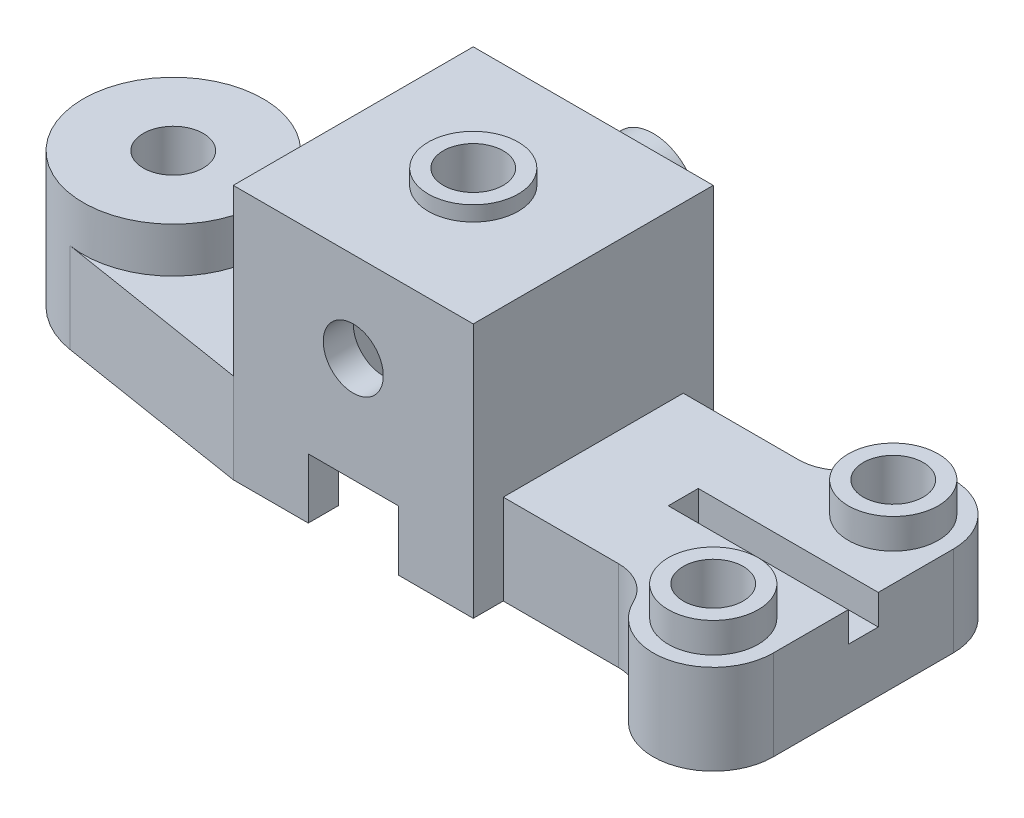
from build123d import *

# Parameters (mm, degrees)
SKETCH2_W                                = 80
SKETCH2_H                                = 80
BOSS_EXTRUDE1_DEPTH                      = 85
SKETCH3_W                                = 30
SKETCH3_H                                = 40
CUT_EXTRUDE1_DEPTH                       = 124.389626793
SKETCH4_R                                = 15
BOSS_EXTRUDE2_DEPTH                      = 20
SKETCH5_R                                = 15
BOSS_EXTRUDE3_DEPTH                      = 5
SKETCH7_R                                = 30
BOSS_EXTRUDE4_DEPTH                      = 45
BOSS_EXTRUDE5_DEPTH                      = 30
CUT_EXTRUDE2_DEPTH                       = 15
SKETCH11_W                               = 60
SKETCH11_H                               = 60
CUT_EXTRUDE3_DEPTH                       = 75
BOSS_EXTRUDE6_DEPTH                      = 30
SKETCH21_R                               = 15
BOSS_EXTRUDE7_DEPTH                      = 10
F_20_0_20_DIAMETER_HOLE1_D               = 20
F_20_0_20_DIAMETER_HOLE2_D               = 20
F_20_0_20_DIAMETER_HOLE3_D               = 20
CBORE_FOR_M10_HEX_HEAD_BOLT2_D           = 10
CBORE_FOR_M10_HEX_HEAD_BOLT2_CBORE_D     = 20
CBORE_FOR_M10_HEX_HEAD_BOLT2_CBORE_DEPTH = 15
BOSS_EXTRUDE9_DEPTH                      = 5
SKETCH25_W                               = 10
SKETCH25_H                               = 10
CUT_EXTRUDE4_DEPTH                       = 60
FILLET1_R                                = 10


with BuildPart() as part:
    # Sketch2 → Boss-Extrude1 (new body)
    with BuildSketch(Plane(origin=(0, 0, 0), x_dir=(1, 0, 0), z_dir=(0, 1, 0))):
        Rectangle(SKETCH2_W, SKETCH2_H)
    extrude(amount=BOSS_EXTRUDE1_DEPTH)

    # Sketch3 → Cut-Extrude1 (cut, through all)
    with BuildSketch(Plane.XY.offset(40)):
        Rectangle(SKETCH3_W, SKETCH3_H)
    extrude(amount=-CUT_EXTRUDE1_DEPTH, mode=Mode.SUBTRACT)

    # Sketch4 → Boss-Extrude2 (add)
    with BuildSketch(Plane(origin=(0, 0, -40), x_dir=(-1, 0, 0), z_dir=(0, 0, -1))):
        with Locations((0, 55)):
            Circle(SKETCH4_R)
    extrude(amount=BOSS_EXTRUDE2_DEPTH)

    # Sketch5 → Boss-Extrude3 (add)
    with BuildSketch(Plane(origin=(0, 85, 0), x_dir=(1, 0, 0), z_dir=(0, 1, 0))):
        with Locations(Location((0, 0, 0), (0, 0, 270))):
            Circle(SKETCH5_R)
    extrude(amount=BOSS_EXTRUDE3_DEPTH)



with BuildPart() as body_2:
    # Sketch7 → Boss-Extrude4 (new body)
    with BuildSketch(Plane(origin=(0, 0, 0), x_dir=(1, 0, 0), z_dir=(0, 1, 0))):
        with Locations(Location((-100, 0, 0), (0, 0, 90))):
            Circle(SKETCH7_R)
    extrude(amount=BOSS_EXTRUDE4_DEPTH)


with BuildPart() as part_1:
    add(part.part)

    add(body_2.part)  # Boss-Extrude5 merges body 2
    # Sketch9 → Boss-Extrude5 (add)
    with BuildSketch(Plane(origin=(0, 0, 0), x_dir=(1, 0, 0), z_dir=(0, 1, 0))):
        with BuildLine():
            Line((-40, 0), (-40, 40))
            Line((-40, 40), (-104.747935056, 29.621902584))
            ThreePointArc((-104.747935056, 29.621902584), (-80.53770378, 22.830221765), (-70, 0))
            Line((-70, 0), (-40, 0))
        make_face()
        with BuildLine():
            Line((-40, -40), (-40, 0))
            Line((-40, 0), (-70, 0))
            ThreePointArc((-70, 0), (-80.53770378, -22.830221765), (-104.747935056, -29.621902584))
            Line((-104.747935056, -29.621902584), (-40, -40))
        make_face()
    extrude(amount=BOSS_EXTRUDE5_DEPTH)

    # Sketch10 → Cut-Extrude2 (cut)
    with BuildSketch(Plane.XZ):
        with BuildLine():
            Line((-50, 28.269512751), (-103.165290037, 19.747935056))
            ThreePointArc((-103.165290037, 19.747935056), (-120, 0), (-103.165290037, -19.747935056))
            Line((-103.165290037, -19.747935056), (-50, -28.269512751))
            Line((-50, -28.269512751), (-50, 28.269512751))
        make_face()
    extrude(amount=-CUT_EXTRUDE2_DEPTH, mode=Mode.SUBTRACT)

    # Sketch11 → Cut-Extrude3 (cut)
    with BuildSketch(Plane.XZ):
        Rectangle(SKETCH11_W, SKETCH11_H)
    extrude(amount=-CUT_EXTRUDE3_DEPTH, mode=Mode.SUBTRACT)

    # Sketch12 → Boss-Extrude6 (add)
    with BuildSketch(Plane(origin=(0, 0, 0), x_dir=(1, 0, 0), z_dir=(0, 1, 0))):
        with BuildLine():
            Line((40, 30), (78.377223398, 30))
            ThreePointArc((78.377223398, 30), (86.395060656, 32.322686179), (91.929841942, 38.571428571))
            ThreePointArc((91.929841942, 38.571428571), (114.392996633, 49.511575554), (130, 30))
            Line((130, 30), (130, -30))
            ThreePointArc((130, -30), (114.392996633, -49.511575554), (91.929841942, -38.571428571))
            ThreePointArc((91.929841942, -38.571428571), (86.395060656, -32.322686179), (78.377223398, -30))
            Line((78.377223398, -30), (40, -30))
            Line((40, -30), (40, 30))
        make_face()
    extrude(amount=BOSS_EXTRUDE6_DEPTH)

    # Sketch21 → Boss-Extrude7 (add)
    with BuildSketch(Plane(origin=(0, 30, 0), x_dir=(1, 0, 0), z_dir=(0, 1, 0))):
        with Locations(Location((110, 30, 0), (0, 0, 90))):
            Circle(SKETCH21_R)
        with Locations(Location((110, -30, 0), (0, 0, 90))):
            Circle(SKETCH21_R)
    extrude(amount=BOSS_EXTRUDE7_DEPTH)

    # Ø20.0 (20) Diameter Hole1 (through all)
    with Locations(Plane(origin=(0, 45, 0), x_dir=(1, 0, 0), z_dir=(0, 1, 0))):
        with Locations((-100, 0)):
            Hole(F_20_0_20_DIAMETER_HOLE1_D / 2)

    # Ø20.0 (20) Diameter Hole2 (through all)
    with Locations(Plane(origin=(0, 90, 0), x_dir=(1, 0, 0), z_dir=(0, 1, 0))):
        with Locations((0, 0)):
            Hole(F_20_0_20_DIAMETER_HOLE2_D / 2)

    # Ø20.0 (20) Diameter Hole3 (through all)
    with Locations(Plane(origin=(0, 0, -60), x_dir=(-1, 0, 0), z_dir=(0, 0, -1))):
        with Locations((0, 55)):
            Hole(F_20_0_20_DIAMETER_HOLE3_D / 2)

    # CBORE for M10 Hex Head Bolt2 (through all)
    with Locations(Plane(origin=(0, 40, 0), x_dir=(1, 0, 0), z_dir=(0, 1, 0))):
        with Locations((110, 30), (110, -30)):
            CounterBoreHole(CBORE_FOR_M10_HEX_HEAD_BOLT2_D / 2, CBORE_FOR_M10_HEX_HEAD_BOLT2_CBORE_D / 2, CBORE_FOR_M10_HEX_HEAD_BOLT2_CBORE_DEPTH)

    # Sketch24 → Boss-Extrude9 (add, symmetric)
    with BuildSketch(Plane.XY):
        Polygon((-40, 85), (-70, 45), (-71.999098595, 45), (-71.999098595, 30), (-70, 30), (-40, 30), align=None)
    extrude(amount=BOSS_EXTRUDE9_DEPTH, both=True)

    # Sketch25 → Cut-Extrude4 (cut)
    with BuildSketch(Plane(origin=(130, 0, 0), x_dir=(0, 0, -1), z_dir=(1, 0, 0))):
        with Locations((0, 25)):
            Rectangle(SKETCH25_W, SKETCH25_H)
    extrude(amount=-CUT_EXTRUDE4_DEPTH, mode=Mode.SUBTRACT)

    # Fillet1
    fillet1_edges = [part_1.edges().sort_by_distance(p)[0] for p in [
        (-30, 37.5, 30),
        (30, 37.5, -30),
        (-30, 37.5, -30),
        (30, 37.5, 30),
    ]]
    fillet(fillet1_edges, radius=FILLET1_R)


solid = part_1.part
